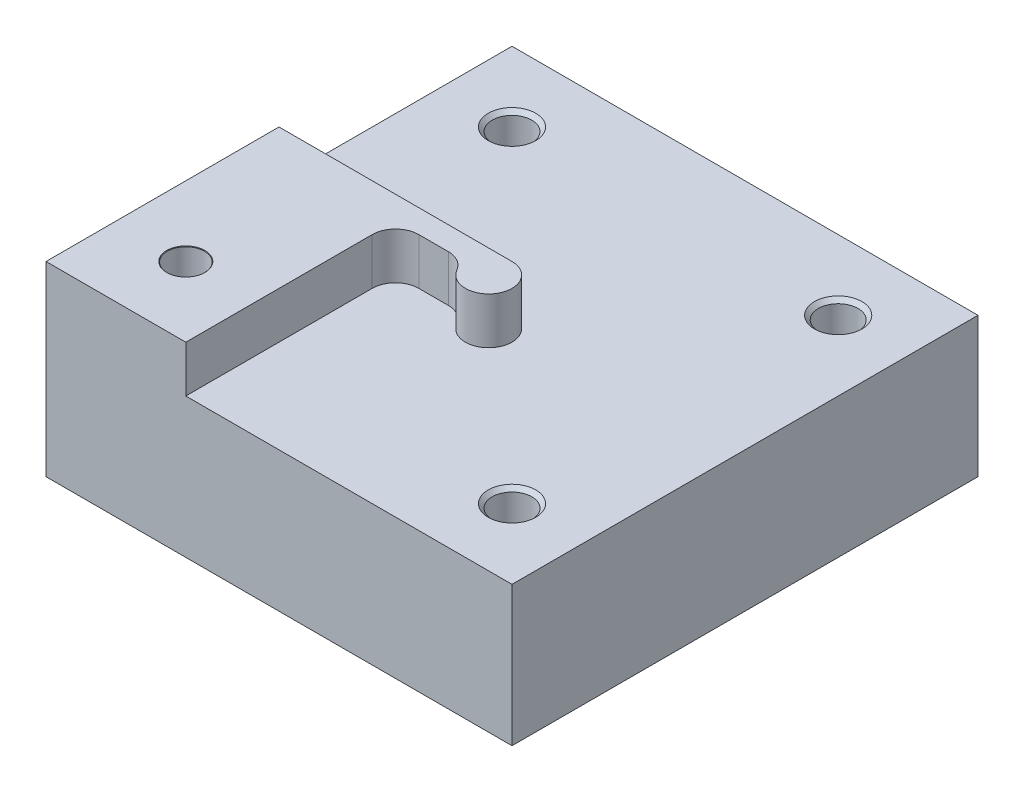
from build123d import *

# Parameters (mm, degrees)
SKETCH2_W           = 100
SKETCH2_H           = 100
BOSS_EXTRUDE1_DEPTH = 30
BOSS_EXTRUDE2_DEPTH = 10
SKETCH5_R           = 4.25
CUT_EXTRUDE1_DEPTH  = 15
CHAMFER1_SIZE       = 0.85
SKETCH7_R           = 4
CUT_EXTRUDE2_DEPTH  = 15
CHAMFER2_SIZE       = 0.1


with BuildPart() as part:
    # Sketch2 → Boss-Extrude1 (new body)
    with BuildSketch(Plane(origin=(0, 0, 0), x_dir=(1, 0, 0), z_dir=(0, 1, 0))):
        Rectangle(SKETCH2_W, SKETCH2_H)
    extrude(amount=BOSS_EXTRUDE1_DEPTH)

    # Sketch4 → Boss-Extrude2 (add)
    with BuildSketch(Plane(origin=(0, 30, 0), x_dir=(1, 0, 0), z_dir=(0, 1, 0))):
        with BuildLine():
            Line((-50, -50), (-50, 0))
            Line((-50, 0), (0, 0))
            ThreePointArc((0, 0), (4.330127019, -7.5), (-4.330127019, -7.5))
            ThreePointArc((-4.330127019, -7.5), (-6.160254038, -5.669872981), (-8.660254038, -5))
            Line((-8.660254038, -5), (-15, -5))
            ThreePointArc((-15, -5), (-18.535533906, -6.464466094), (-20, -10))
            Line((-20, -10), (-20, -50))
            Line((-20, -50), (-50, -50))
        make_face()
    extrude(amount=BOSS_EXTRUDE2_DEPTH)

    # Sketch5 → Cut-Extrude1 (cut)
    with BuildSketch(Plane(origin=(0, 30, 0), x_dir=(1, 0, 0), z_dir=(0, 1, 0))):
        with Locations(Location((35, 35, 0), (0, 0, 270))):
            Circle(SKETCH5_R)
        with Locations(Location((-35, 35, 0), (0, 0, 270))):
            Circle(SKETCH5_R)
        with Locations(Location((35, -35, 0), (0, 0, 270))):
            Circle(SKETCH5_R)
    extrude(amount=-CUT_EXTRUDE1_DEPTH, mode=Mode.SUBTRACT)

    # Chamfer1
    chamfer1_edges = [part.edges().sort_by_distance(p)[0] for p in [
        (35, 30, 30.75),
        (-35, 30, -39.25),
        (35, 30, -39.25),
    ]]
    chamfer(chamfer1_edges, length=CHAMFER1_SIZE)

    # Sketch7 → Cut-Extrude2 (cut)
    with BuildSketch(Plane(origin=(0, 40, 0), x_dir=(1, 0, 0), z_dir=(0, 1, 0))):
        with Locations(Location((-35, -35, 0), (0, 0, 270))):
            Circle(SKETCH7_R)
    extrude(amount=-CUT_EXTRUDE2_DEPTH, mode=Mode.SUBTRACT)

    # Chamfer2
    chamfer2_edges = [part.edges().sort_by_distance(p)[0] for p in [
        (-35, 40, 31),
    ]]
    chamfer(chamfer2_edges, length=CHAMFER2_SIZE)


solid = part.part
